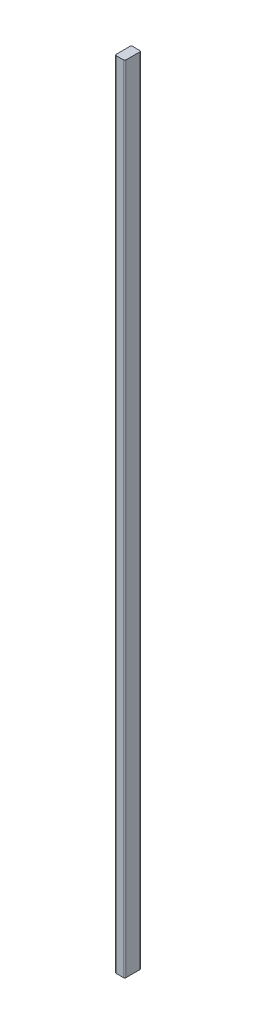
from build123d import *

# Parameters (mm, degrees)
BOSS_EXTRUDE1_DEPTH = 489


with BuildPart() as part:
    # Sketch1 → Boss-Extrude1 (new body)
    with BuildSketch(Plane(origin=(0, 0, 0), x_dir=(1, 0, 0), z_dir=(0, 1, 0))):
        with BuildLine():
            Line((2.25, 5), (-2.25, 5))
            ThreePointArc((-2.25, 5), (-2.780330086, 4.780330086), (-3, 4.25))
            Line((-3, 4.25), (-3, -4.25))
            ThreePointArc((-3, -4.25), (-2.780330086, -4.780330086), (-2.25, -5))
            Line((-2.25, -5), (2.25, -5))
            ThreePointArc((2.25, -5), (2.780330086, -4.780330086), (3, -4.25))
            Line((3, -4.25), (3, 4.25))
            ThreePointArc((3, 4.25), (2.780330086, 4.780330086), (2.25, 5))
        make_face()
    extrude(amount=BOSS_EXTRUDE1_DEPTH)


solid = part.part
